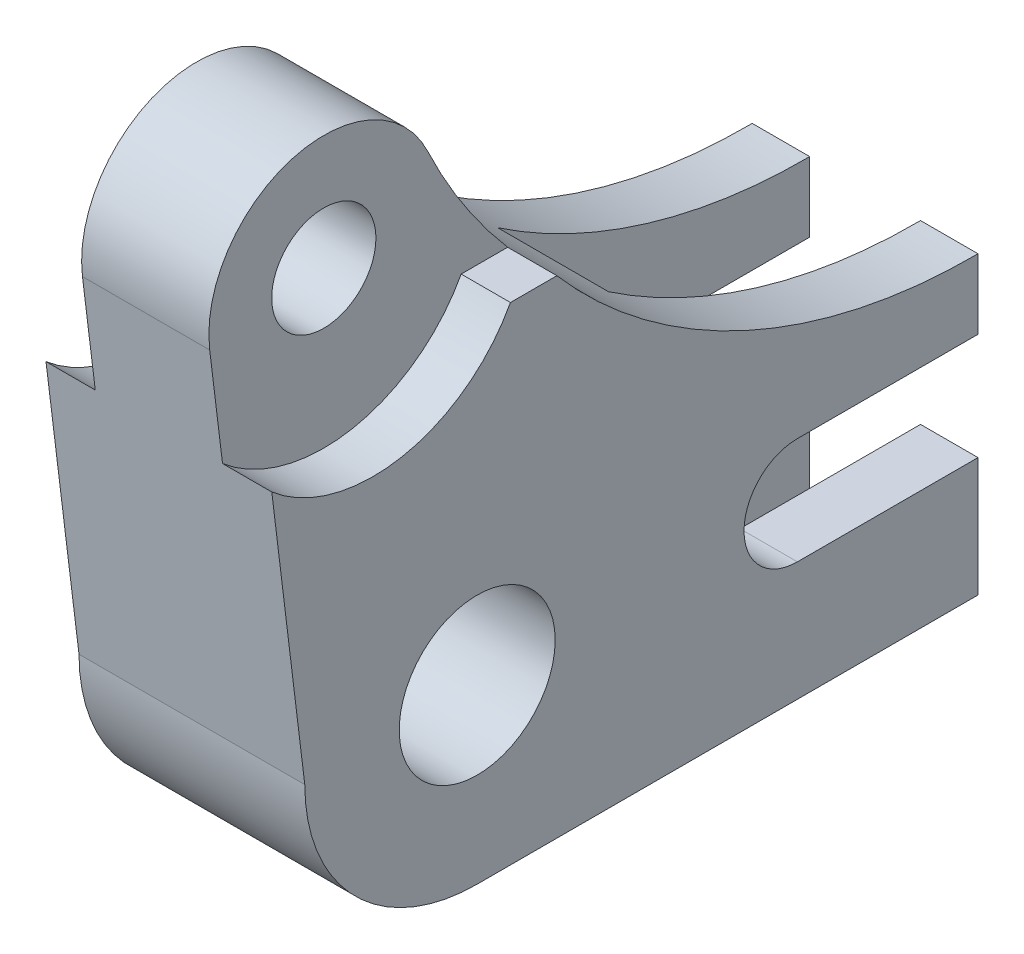
from build123d import *

# Parameters (mm, degrees)
SKETCH1_R               = 9.5
SKETCH1_R_2             = 6.35
BOSS_EXTRUDE1_DEPTH     = 27.5
CUT_EXTRUDE2_DEPTH      = 91.767085063
CUT_EXTRUDE2_DEPTH_BACK = 6
CUT_EXTRUDE3_DEPTH      = 91.767085063
CUT_EXTRUDE3_DEPTH_BACK = 6
CUT_EXTRUDE5_DEPTH      = 6.75
CUT_EXTRUDE5_DEPTH_BACK = 6.75


with BuildPart() as part:
    # Sketch1 → Boss-Extrude1 (new body)
    with BuildSketch(Plane(origin=(0, 0, 0), x_dir=(0, 0, -1), z_dir=(1, 0, 0))):
        with BuildLine():
            Line((39, 6.5), (61, 6.5))
            Line((61, 6.5), (61, 15))
            ThreePointArc((61, 15), (24.894386745, 25.257382556), (-0.029226303, 53.322355709))
            ThreePointArc((-0.029226303, 53.322355709), (-16.577537576, 60.777514808), (-26.578667772, 45.631446077))
            Line((-26.578667772, 45.631446077), (-21, 0))
            ThreePointArc((-21, 0), (-14.849242405, -14.849242405), (0, -21))
            Line((0, -21), (61, -21))
            Line((61, -21), (61, -6.5))
            Line((61, -6.5), (39, -6.5))
            ThreePointArc((39, -6.5), (32.5, 0), (39, 6.5))
        make_face()
        Circle(SKETCH1_R, mode=Mode.SUBTRACT)
        with Locations((-12.68213321, 47.330365488)):
            Circle(SKETCH1_R_2, mode=Mode.SUBTRACT)
    extrude(amount=BOSS_EXTRUDE1_DEPTH)

    # Sketch4 → Cut-Extrude2 (cut, two sides: drawn at the far end of the back side and taken through both)
    with BuildSketch(Plane.ZY.offset(-CUT_EXTRUDE2_DEPTH_BACK)):
        with BuildLine():
            Line((-222.712922977, 38.330365488), (-9.709497533, 38.330365488))
            Line((-9.709497533, 38.330365488), (-4.051067321, 38.330365488))
            ThreePointArc((-4.051067321, 38.330365488), (9.181632836, 28.655609877), (25.019880988, 32.881144756))
            Line((25.019880988, 32.881144756), (187.005855245, 171.196015234))
            Line((187.005855245, 171.196015234), (55.595163053, 576.428130178))
            Line((55.595163053, 576.428130178), (-354.123615169, 443.562480432))
            Line((-354.123615169, 443.562480432), (-222.712922977, 38.330365488))
        make_face()
    extrude(amount=CUT_EXTRUDE2_DEPTH + CUT_EXTRUDE2_DEPTH_BACK, mode=Mode.SUBTRACT)

    # Sketch6 → Cut-Extrude3 (cut, two sides: drawn at the far end of the back side and taken through both)
    with BuildSketch(Plane(origin=(27.5, 0, 0), x_dir=(0, 0, -1), z_dir=(1, 0, 0)).offset(-CUT_EXTRUDE3_DEPTH_BACK)):
        with BuildLine():
            Line((-187.005855245, 171.196015234), (-25.019880988, 32.881144756))
            ThreePointArc((-25.019880988, 32.881144756), (-9.181632836, 28.655609877), (4.051067321, 38.330365488))
            Line((4.051067321, 38.330365488), (9.709497533, 38.330365488))
            Line((9.709497533, 38.330365488), (222.712922977, 38.330365488))
            Line((222.712922977, 38.330365488), (354.123615169, 443.562480432))
            Line((354.123615169, 443.562480432), (-55.595163053, 576.428130178))
            Line((-55.595163053, 576.428130178), (-187.005855245, 171.196015234))
        make_face()
    extrude(amount=CUT_EXTRUDE3_DEPTH + CUT_EXTRUDE3_DEPTH_BACK, mode=Mode.SUBTRACT)

    # Sketch12 → Cut-Extrude5 (cut, two sides: drawn at the far end of the back side and taken through both)
    with BuildSketch(Plane(origin=(13.75, 0, 0), x_dir=(0, 0, -1), z_dir=(1, 0, 0)).offset(-CUT_EXTRUDE5_DEPTH_BACK)):
        with BuildLine():
            ThreePointArc((61, 15), (41.129282246, 17.866834211), (23, 26.491988568))
            Line((23, 26.491988568), (23, -21))
            Line((23, -21), (61, -21))
            Line((61, -21), (61, -6.5))
            Line((61, -6.5), (39, -6.5))
            ThreePointArc((39, -6.5), (32.5, 0), (39, 6.5))
            Line((39, 6.5), (61, 6.5))
            Line((61, 6.5), (61, 15))
        make_face()
    extrude(amount=CUT_EXTRUDE5_DEPTH + CUT_EXTRUDE5_DEPTH_BACK, mode=Mode.SUBTRACT)


solid = part.part
